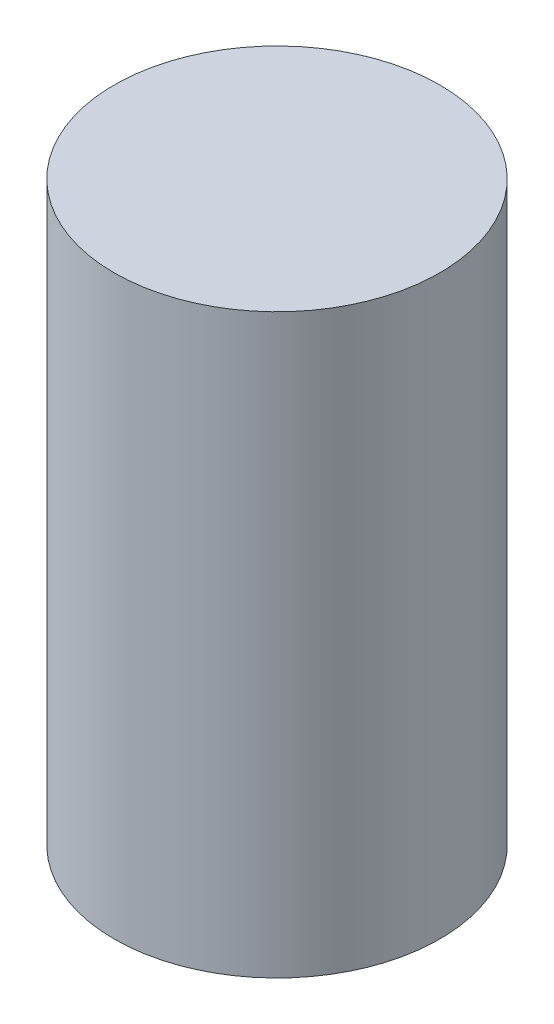
from build123d import *

# Parameters (mm, degrees)
SKETCH1_R      = 45.72
EXTRUDE1_DEPTH = 162.052


with BuildPart() as part:
    # Sketch1 → Extrude1 (new body)
    with BuildSketch(Plane(origin=(0, 0, 0), x_dir=(1, 0, 0), z_dir=(0, 1, 0))):
        with Locations(Location((0, 0, 0), (0, 0, 270))):
            Circle(SKETCH1_R)
    extrude(amount=EXTRUDE1_DEPTH)


solid = part.part
